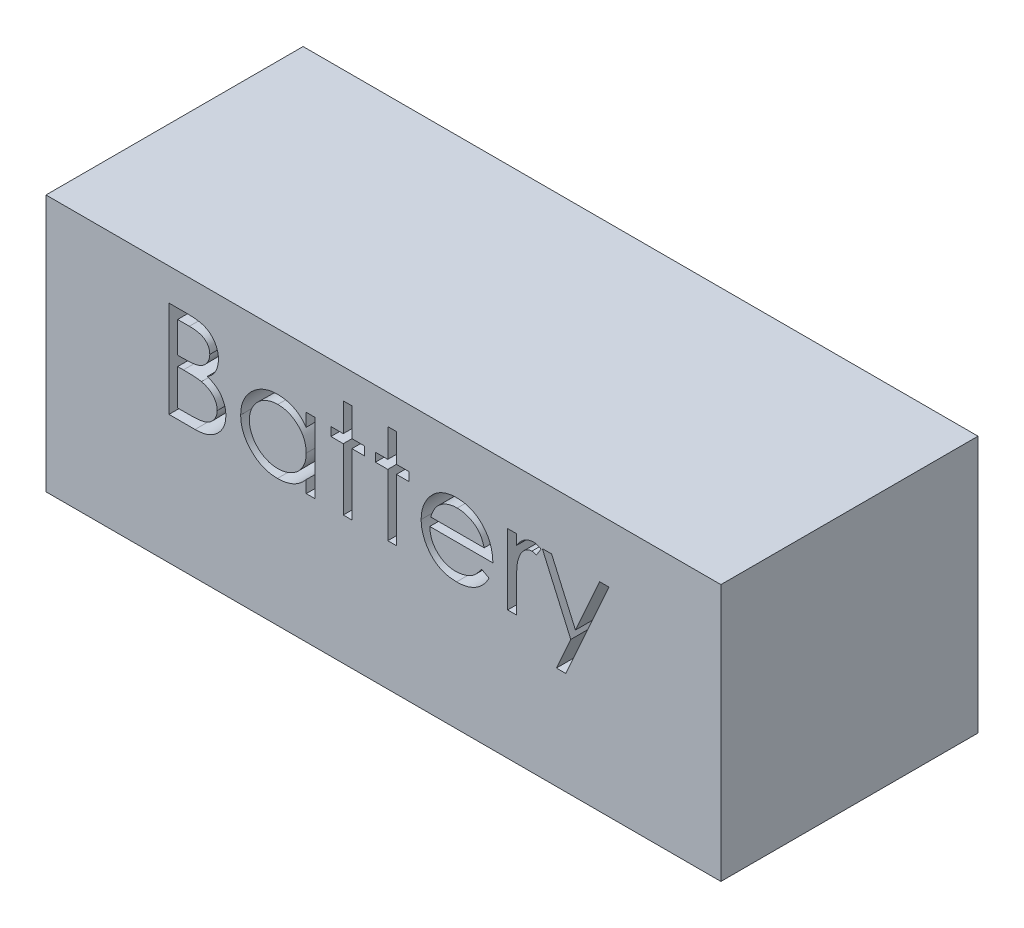
from build123d import *

# Parameters (mm, degrees)
SKETCH1_W           = 133.35
SKETCH1_H           = 50.8
BOSS_EXTRUDE1_DEPTH = 50.8
CUT_EXTRUDE2_DEPTH  = 106.457657268


with BuildPart() as part:
    # Sketch1 → Boss-Extrude1 (new body)
    with BuildSketch(Plane.XY):
        with Locations((-11.928359708, 23.202359192)):
            Rectangle(SKETCH1_W, SKETCH1_H)
    extrude(amount=BOSS_EXTRUDE1_DEPTH)

    # Sketch2 → Cut-Extrude2 (cut, through all)
    # profile 1 of 7: a face of its own
    with BuildSketch(Plane.XY.offset(50.8)):
        with BuildLine():
            Line((-54.302398169, 42.252359192), (-50.58551115, 42.252359192))
            add(Edge.make_bspline(
                [(-50.58551115, 42.252359192), (-50.403564719, 42.251402608), (-50.050907253, 42.249548509), (-49.538084291, 42.220793181), (-49.057758621, 42.181584635), (-48.609790946, 42.119372274), (-48.194388266, 42.044305601), (-47.810298697, 41.953400002), (-47.458743617, 41.844398005), (-47.039030009, 41.671063245), (-46.560490412, 41.413490001), (-46.04233916, 41.03287881), (-45.599267514, 40.567337832), (-45.217253416, 40.042196522), (-44.913535894, 39.464514679), (-44.693811576, 38.848061094), (-44.554703711, 38.200787042), (-44.540397519, 37.756414888), (-44.5331674, 37.531836356)],
                knots=[0, 0, 0, 0, 1.001505555, 1.941167018, 2.826882275, 3.653841531, 4.429895133, 5.150066043, 5.825578002, 6.45369114, 7.647487171, 8.808567382, 9.977351308, 11.170798116, 12.373658725, 13.556498008, 14.765093433, 16, 16, 16, 16], degree=3))
            add(Edge.make_bspline(
                [(-44.5331674, 37.531836356), (-44.539117632, 37.321456017), (-44.550810399, 36.908038811), (-44.662621703, 36.303369445), (-44.837667627, 35.727780668), (-45.080991912, 35.183373113), (-45.397232777, 34.682447305), (-45.772018768, 34.220962328), (-46.224193936, 33.818457289), (-46.562974999, 33.593433777), (-46.735060429, 33.479132029)],
                knots=[0, 0, 0, 0, 1.044552857, 2.05264487, 3.044412934, 4.028983338, 5.005914585, 5.980388656, 6.974128949, 8, 8, 8, 8], degree=3))
            add(Edge.make_bspline(
                [(-46.735060429, 33.479132029), (-46.518650102, 33.39604682), (-46.104603537, 33.237084234), (-45.534812526, 32.95603978), (-45.04389487, 32.650357437), (-44.628076118, 32.316536938), (-44.272452596, 31.956716125), (-43.961921586, 31.565619003), (-43.696955821, 31.138143764), (-43.469918337, 30.678747379), (-43.292760107, 30.192120744), (-43.160085542, 29.682828377), (-43.084062712, 29.152696512), (-43.073244264, 28.791914661), (-43.067782785, 28.609781067)],
                knots=[0, 0, 0, 0, 1.27268992, 2.434971085, 3.483601985, 4.442670788, 5.356604649, 6.2567628, 7.179492994, 8.113709626, 9.066344395, 10.018646069, 10.999752585, 12, 12, 12, 12], degree=3))
            add(Edge.make_bspline(
                [(-43.067782785, 28.609781067), (-43.073099618, 28.423815663), (-43.083560637, 28.057923521), (-43.160740197, 27.520413431), (-43.291418337, 27.006744079), (-43.471419862, 26.513593013), (-43.706346174, 26.041914281), (-43.99224838, 25.591173516), (-44.333143034, 25.165899516), (-44.71448522, 24.761366653), (-45.145897755, 24.397632554), (-45.611347793, 24.073697065), (-46.116697048, 23.807290641), (-46.653645758, 23.583502009), (-47.22821725, 23.412557115), (-47.837831442, 23.292963534), (-48.48196257, 23.212381833), (-48.923975644, 23.20575676), (-49.150655381, 23.202359192)],
                knots=[0, 0, 0, 0, 0.978564426, 1.925352924, 2.850884081, 3.763762016, 4.682927383, 5.618979971, 6.567305752, 7.547517671, 8.540179244, 9.531824382, 10.526200242, 11.540722885, 12.589160233, 13.674978461, 14.80764778, 16, 16, 16, 16], degree=3))
            Line((-49.150655381, 23.202359192), (-54.302398169, 23.202359192))
            Line((-54.302398169, 23.202359192), (-54.302398169, 42.252359192))
        make_face()
        with BuildLine():
            Line((-52.592782785, 40.298513038), (-52.592782785, 34.192743807))
            Line((-52.592782785, 34.192743807), (-51.444134948, 34.192743807))
            add(Edge.make_bspline(
                [(-51.444134948, 34.192743807), (-51.276229362, 34.194920531), (-50.951801552, 34.199126405), (-50.481974687, 34.211174262), (-50.045865659, 34.244909327), (-49.644227253, 34.278634696), (-49.277691951, 34.333469238), (-48.947071791, 34.39874065), (-48.647177999, 34.46777189), (-48.30134133, 34.585171526), (-47.909058567, 34.758677158), (-47.490866957, 35.027945295), (-47.122197916, 35.348662131), (-46.810881794, 35.718727223), (-46.556093647, 36.126213178), (-46.379126141, 36.564618341), (-46.259125922, 37.023016489), (-46.248286302, 37.337712979), (-46.242782785, 37.497491404)],
                knots=[0, 0, 0, 0, 1.156816544, 2.235205308, 3.236616184, 4.169592532, 5.011045266, 5.787822928, 6.49130361, 7.128639758, 8.301311294, 9.436451833, 10.541879658, 11.654887649, 12.756523258, 13.837046038, 14.901820046, 16, 16, 16, 16], degree=3))
            add(Edge.make_bspline(
                [(-46.242782785, 37.497491404), (-46.245646708, 37.603223103), (-46.251264607, 37.810627377), (-46.297274726, 38.112974576), (-46.375475381, 38.397329857), (-46.475919462, 38.667590086), (-46.616283611, 38.915304585), (-46.781547604, 39.149038265), (-46.981222576, 39.360831367), (-47.208501663, 39.558785351), (-47.469805739, 39.734287709), (-47.764978913, 39.887998149), (-48.098014698, 40.011772947), (-48.46330038, 40.12017372), (-48.866458728, 40.196310005), (-49.302837369, 40.259737729), (-49.776010625, 40.292028797), (-50.103371826, 40.296303414), (-50.272590477, 40.298513038)],
                knots=[0, 0, 0, 0, 0.91205012, 1.789085906, 2.630437955, 3.453916878, 4.269457761, 5.079663411, 5.91843418, 6.774407191, 7.675494373, 8.627863946, 9.638891023, 10.736472738, 11.911756761, 13.175263542, 14.539845004, 16, 16, 16, 16], degree=3))
            Line((-50.272590477, 40.298513038), (-52.592782785, 40.298513038))
        make_face(mode=Mode.SUBTRACT)
        with BuildLine():
            Line((-52.592782785, 32.238897654), (-52.592782785, 25.156205346))
            Line((-52.592782785, 25.156205346), (-50.158107304, 25.156205346))
            add(Edge.make_bspline(
                [(-50.158107304, 25.156205346), (-49.983832864, 25.158294028), (-49.647941857, 25.162319688), (-49.16297659, 25.175461763), (-48.713488554, 25.205355435), (-48.301528844, 25.25241356), (-47.922649094, 25.303459119), (-47.581394453, 25.37210052), (-47.274998643, 25.450744148), (-46.919719911, 25.572305856), (-46.519650816, 25.761153791), (-46.088517441, 26.045892652), (-45.705197596, 26.385109513), (-45.379686114, 26.777707774), (-45.112915419, 27.204598282), (-44.918847871, 27.657146544), (-44.799154779, 28.127874915), (-44.784664972, 28.448822307), (-44.777398169, 28.609781067)],
                knots=[0, 0, 0, 0, 1.160039823, 2.235823828, 3.228722157, 4.157150951, 4.99529583, 5.772374946, 6.472645482, 7.099169577, 8.269452708, 9.405989375, 10.527446681, 11.663510218, 12.788923519, 13.866172445, 14.929861265, 16, 16, 16, 16], degree=3))
            add(Edge.make_bspline(
                [(-44.777398169, 28.609781067), (-44.778900966, 28.710437678), (-44.781882318, 28.910127298), (-44.826843665, 29.2035834), (-44.892233442, 29.487841368), (-44.976768818, 29.763673069), (-45.099883346, 30.026091589), (-45.243610398, 30.280286949), (-45.412128885, 30.526595173), (-45.674714987, 30.837993295), (-46.056651075, 31.19677018), (-46.599340809, 31.548038585), (-47.216410031, 31.831327363), (-47.663962528, 31.951611656), (-47.895156583, 32.013747413)],
                knots=[0, 0, 0, 0, 0.723448775, 1.435228256, 2.130040452, 2.821711965, 3.505591119, 4.210454504, 4.921174351, 5.648778258, 7.137944449, 8.670945889, 10.280296675, 12, 12, 12, 12], degree=3))
            add(Edge.make_bspline(
                [(-47.895156583, 32.013747413), (-47.987843519, 32.032552942), (-48.188807914, 32.073327206), (-48.516509173, 32.116367706), (-48.890628688, 32.154712961), (-49.312030349, 32.183076547), (-49.781247313, 32.212394734), (-50.299281684, 32.223796546), (-50.864017925, 32.237399662), (-51.255862124, 32.23838555), (-51.459399371, 32.238897654)],
                knots=[0, 0, 0, 0, 0.634451884, 1.375622551, 2.216452059, 3.157844607, 4.20941857, 5.370758133, 6.634282058, 8, 8, 8, 8], degree=3))
            Line((-51.459399371, 32.238897654), (-52.592782785, 32.238897654))
        make_face(mode=Mode.SUBTRACT)
    # profile 2 of 7: a face of its own
    with BuildSketch(Plane.XY.offset(50.8)):
        with BuildLine():
            Line((-25.4831674, 37.123513038), (-25.4831674, 23.202359192))
            Line((-25.4831674, 23.202359192), (-27.192782785, 23.202359192))
            Line((-27.192782785, 23.202359192), (-27.192782785, 25.610321932))
            add(Edge.make_bspline(
                [(-27.192782785, 25.610321932), (-27.385562202, 25.392392142), (-27.76177366, 24.967099417), (-28.390103173, 24.411480735), (-29.056135684, 23.952221585), (-29.756638589, 23.58129133), (-30.490979314, 23.30266028), (-31.257530017, 23.104615614), (-32.05660339, 22.977286311), (-32.602262636, 22.964571678), (-32.878780381, 22.958128423)],
                knots=[0, 0, 0, 0, 1.074387032, 2.096679803, 3.090159297, 4.057316773, 5.018401886, 5.985159533, 6.978961417, 8, 8, 8, 8], degree=3))
            add(Edge.make_bspline(
                [(-32.878780381, 22.958128423), (-33.124623101, 22.964803392), (-33.60943583, 22.977966726), (-34.322608379, 23.080087265), (-35.008910479, 23.244083934), (-35.668990654, 23.47214449), (-36.298577617, 23.774662962), (-36.903061857, 24.136837469), (-37.479311795, 24.568133987), (-38.018544028, 25.061191684), (-38.515106773, 25.596741543), (-38.950868843, 26.167945162), (-39.31419632, 26.772332559), (-39.618017045, 27.402251582), (-39.852040006, 28.062551359), (-40.015182215, 28.750948516), (-40.117183789, 29.466629113), (-40.130341683, 29.953979946), (-40.137013554, 30.201097173)],
                knots=[0, 0, 0, 0, 1.033919861, 2.038935746, 3.024066025, 3.998881131, 4.97069526, 5.957263378, 6.95902576, 7.993208707, 9.027059324, 10.027763471, 11.009749337, 11.988697705, 12.965288445, 13.950418724, 14.960734635, 16, 16, 16, 16], degree=3))
            add(Edge.make_bspline(
                [(-40.137013554, 30.201097173), (-40.13019381, 30.443106759), (-40.116711543, 30.921546657), (-40.016273304, 31.625192141), (-39.847375957, 32.302927246), (-39.610351243, 32.952570037), (-39.306411459, 33.574906596), (-38.936688586, 34.170377075), (-38.501155921, 34.740621938), (-37.999039249, 35.272232473), (-37.455108571, 35.763290388), (-36.873219622, 36.190059621), (-36.26784719, 36.558632755), (-35.629601376, 36.850660962), (-34.967928991, 37.086930516), (-34.276939522, 37.250395671), (-33.55950793, 37.346719663), (-33.072423966, 37.360668422), (-32.8253549, 37.367743807)],
                knots=[0, 0, 0, 0, 1.020392517, 2.01726096, 2.990465484, 3.961182959, 4.928053699, 5.906110375, 6.912531644, 7.948652711, 8.985773172, 9.998621852, 10.987621588, 11.969261332, 12.953316658, 13.946091881, 14.958173133, 16, 16, 16, 16], degree=3))
            add(Edge.make_bspline(
                [(-32.8253549, 37.367743807), (-32.541238524, 37.359918331), (-31.984099721, 37.344572942), (-31.169151556, 37.216868669), (-30.398200898, 37.001122155), (-29.665296496, 36.707656915), (-28.97307019, 36.317683118), (-28.328075376, 35.825757902), (-27.723561816, 35.234983727), (-27.373149086, 34.781210308), (-27.192782785, 34.547641644)],
                knots=[0, 0, 0, 0, 1.038897134, 2.037228247, 3.008116434, 3.962042015, 4.918381754, 5.904844433, 6.921570401, 8, 8, 8, 8], degree=3))
            Line((-27.192782785, 34.547641644), (-27.192782785, 37.123513038))
            Line((-27.192782785, 37.123513038), (-25.4831674, 37.123513038))
        make_face()
        with BuildLine():
            add(Edge.make_bspline(
                [(-32.802458265, 35.658128423), (-33.052363447, 35.649236766), (-33.545636527, 35.63168605), (-34.269776024, 35.494670312), (-34.962724749, 35.266698448), (-35.621016954, 34.954921243), (-36.234253961, 34.56287912), (-36.782315227, 34.088689876), (-37.269683358, 33.545291271), (-37.679575482, 32.935135498), (-38.013715187, 32.281023317), (-38.248667175, 31.597267447), (-38.403621222, 30.896200355), (-38.419451884, 30.420697736), (-38.427398169, 30.182016644)],
                knots=[0, 0, 0, 0, 1.031046209, 2.035121221, 3.029706178, 4.034933723, 5.034054252, 6.02443088, 7.017295772, 8.038157696, 9.050218397, 10.03989886, 11.016116709, 12, 12, 12, 12], degree=3))
            add(Edge.make_bspline(
                [(-38.427398169, 30.182016644), (-38.417247821, 29.944761918), (-38.396986912, 29.471182424), (-38.251386704, 28.76915957), (-38.007111964, 28.08524257), (-37.673780165, 27.425236305), (-37.256385822, 26.81245713), (-36.772577585, 26.258700177), (-36.217676768, 25.782506847), (-35.603028479, 25.383885196), (-34.946576526, 25.061872047), (-34.256237556, 24.837813352), (-33.544988726, 24.693154289), (-33.061378166, 24.676257065), (-32.817722689, 24.667743807)],
                knots=[0, 0, 0, 0, 0.979072187, 1.954306742, 2.945804271, 3.96968567, 4.997920485, 5.998718438, 6.996577872, 8.005894225, 9.015743152, 10.005417472, 10.995077863, 12, 12, 12, 12], degree=3))
            add(Edge.make_bspline(
                [(-32.817722689, 24.667743807), (-32.570363866, 24.676778754), (-32.078391703, 24.694748366), (-31.352103878, 24.832350682), (-30.647281295, 25.059692284), (-29.973525095, 25.37482896), (-29.345875867, 25.765393997), (-28.782551704, 26.222632592), (-28.306214791, 26.754417066), (-27.902395016, 27.33885176), (-27.585754533, 27.979541341), (-27.355107697, 28.661717436), (-27.218742867, 29.385403794), (-27.201555796, 29.879963168), (-27.192782785, 30.132407269)],
                knots=[0, 0, 0, 0, 1.01762866, 2.023962475, 3.030623092, 4.058876274, 5.077231937, 6.066672613, 7.034107872, 8.005628644, 8.981990164, 9.965428785, 10.961468474, 12, 12, 12, 12], degree=3))
            add(Edge.make_bspline(
                [(-27.192782785, 30.132407269), (-27.198006057, 30.324746032), (-27.208287111, 30.703329585), (-27.286830639, 31.259195074), (-27.411771024, 31.791145782), (-27.587826607, 32.29974099), (-27.819100598, 32.782168717), (-28.098034866, 33.241892897), (-28.429534528, 33.676522519), (-28.808263203, 34.080072663), (-29.222819519, 34.448153836), (-29.661484091, 34.776707775), (-30.129454128, 35.04661238), (-30.618859714, 35.269994158), (-31.130549978, 35.447753246), (-31.668688637, 35.56634055), (-32.227555694, 35.64776744), (-32.608806367, 35.654638399), (-32.802458265, 35.658128423)],
                knots=[0, 0, 0, 0, 1.050140795, 2.067009409, 3.05949893, 4.030605086, 5.00011959, 5.97591094, 6.962425594, 7.979863591, 8.993523472, 9.986985069, 10.967611495, 11.937549037, 12.921786183, 13.919465291, 14.943216303, 16, 16, 16, 16], degree=3))
        make_face(mode=Mode.SUBTRACT)
    # profile 3 of 7: a face of its own
    with BuildSketch(Plane.XY.offset(50.8)):
        Polygon((-19.865859708, 42.740820731), (-18.156244323, 42.740820731), (-18.156244323, 37.123513038), (-15.713936631, 37.123513038), (-15.713936631, 35.413897654), (-18.156244323, 35.413897654), (-18.156244323, 23.202359192), (-19.865859708, 23.202359192), (-19.865859708, 35.413897654), (-22.3081674, 35.413897654), (-22.3081674, 37.123513038), (-19.865859708, 37.123513038), align=None)
    # profile 4 of 7: a face of its own
    with BuildSketch(Plane.XY.offset(50.8)):
        Polygon((-11.073552015, 42.740820731), (-9.363936631, 42.740820731), (-9.363936631, 37.123513038), (-6.921628939, 37.123513038), (-6.921628939, 35.413897654), (-9.363936631, 35.413897654), (-9.363936631, 23.202359192), (-11.073552015, 23.202359192), (-11.073552015, 35.413897654), (-13.515859708, 35.413897654), (-13.515859708, 37.123513038), (-11.073552015, 37.123513038), align=None)
    # profile 5 of 7: a face of its own
    with BuildSketch(Plane.XY.offset(50.8)):
        with BuildLine():
            Line((7.434560965, 27.598513038), (8.953371061, 26.800946932))
            add(Edge.make_bspline(
                [(8.953371061, 26.800946932), (8.83234045, 26.586262515), (8.59686281, 26.168571655), (8.191910168, 25.594721101), (7.767410458, 25.078478533), (7.304201718, 24.6336357), (6.816142466, 24.245824591), (6.300526159, 23.906528716), (5.754668451, 23.617412198), (5.17854352, 23.373830582), (4.567313106, 23.186544621), (3.919495996, 23.054260219), (3.233851142, 22.972490714), (2.76388122, 22.962992162), (2.52323284, 22.958128423)],
                knots=[0, 0, 0, 0, 1.120438281, 2.179929193, 3.190490725, 4.156257408, 5.095198341, 6.022838206, 6.959905092, 7.901321166, 8.864066838, 9.862729781, 10.905609505, 12, 12, 12, 12], degree=3))
            add(Edge.make_bspline(
                [(2.52323284, 22.958128423), (2.255760077, 22.964372334), (1.733998203, 22.976552397), (0.974503293, 23.081558524), (0.259423888, 23.252858077), (-0.411199812, 23.492156238), (-1.035725501, 23.804724959), (-1.615394439, 24.185504425), (-2.153255002, 24.632538554), (-2.632358197, 25.149699482), (-3.06367133, 25.703139849), (-3.444267579, 26.279842592), (-3.762443025, 26.878356714), (-4.021265089, 27.494871995), (-4.230297283, 28.125502615), (-4.375984628, 28.77598646), (-4.459966542, 29.444562997), (-4.472835881, 29.896849925), (-4.479321246, 30.124775057)],
                knots=[0, 0, 0, 0, 1.145258523, 2.234067595, 3.276747158, 4.290159414, 5.277019952, 6.260822364, 7.254936242, 8.264827045, 9.274100331, 10.257902744, 11.220704747, 12.172965371, 13.118907548, 14.062713208, 15.023725156, 16, 16, 16, 16], degree=3))
            add(Edge.make_bspline(
                [(-4.479321246, 30.124775057), (-4.473556491, 30.338651206), (-4.462131508, 30.762525488), (-4.390118223, 31.38989938), (-4.262492513, 31.999654243), (-4.087361378, 32.592296739), (-3.861203881, 33.166834582), (-3.584531374, 33.723617443), (-3.256912861, 34.262052847), (-3.003968736, 34.601704189), (-2.876556823, 34.772791884)],
                knots=[0, 0, 0, 0, 1.024358464, 2.0301432, 3.019427413, 4.004406732, 4.986367066, 5.972626655, 6.978780325, 8, 8, 8, 8], degree=3))
            add(Edge.make_bspline(
                [(-2.876556823, 34.772791884), (-2.703976435, 34.978906734), (-2.364282569, 35.384607239), (-1.789754406, 35.917671555), (-1.167634766, 36.364224103), (-0.505720058, 36.734377229), (0.20368275, 37.015629508), (0.951037606, 37.225220777), (1.744854297, 37.342666809), (2.28753557, 37.359255732), (2.565210004, 37.367743807)],
                knots=[0, 0, 0, 0, 1.030682036, 2.02871468, 2.997146059, 3.962720338, 4.930598197, 5.918074684, 6.934738563, 8, 8, 8, 8], degree=3))
            add(Edge.make_bspline(
                [(2.565210004, 37.367743807), (2.850674827, 37.360373913), (3.410691737, 37.345915859), (4.227295139, 37.211878245), (4.999967039, 36.999320769), (5.728398241, 36.699126567), (6.412662597, 36.311815292), (7.048312381, 35.83207184), (7.646218471, 35.274624823), (7.994063736, 34.845927926), (8.171069379, 34.627779865)],
                knots=[0, 0, 0, 0, 1.056321875, 2.072262726, 3.055038591, 4.01806755, 4.982017516, 5.957941055, 6.960871419, 8, 8, 8, 8], degree=3))
            add(Edge.make_bspline(
                [(8.171069379, 34.627779865), (8.291503143, 34.463386086), (8.531569028, 34.135692783), (8.832271101, 33.6013612), (9.093296351, 33.042322108), (9.301937182, 32.449538919), (9.470880753, 31.830035204), (9.593110009, 31.179382211), (9.664790362, 30.497773693), (9.678880271, 30.033353441), (9.686063369, 29.796589961)],
                knots=[0, 0, 0, 0, 0.94817472, 1.890038105, 2.849395472, 3.817997239, 4.812318967, 5.836947057, 6.897266129, 8, 8, 8, 8], degree=3))
            Line((9.686063369, 29.796589961), (-2.769705862, 29.796589961))
            add(Edge.make_bspline(
                [(-2.769705862, 29.796589961), (-2.761326004, 29.613163149), (-2.744847351, 29.25246172), (-2.668020643, 28.7246636), (-2.546923746, 28.221888695), (-2.376730705, 27.747908138), (-2.170626876, 27.296531301), (-1.918156046, 26.8711065), (-1.61695076, 26.473571481), (-1.280986596, 26.100370346), (-0.907023691, 25.768025346), (-0.513599024, 25.470563535), (-0.095078335, 25.221250216), (0.345238377, 25.018885388), (0.806639093, 24.860463867), (1.289269184, 24.752326158), (1.792178931, 24.679897476), (2.135001284, 24.67184387), (2.309530917, 24.667743807)],
                knots=[0, 0, 0, 0, 1.094153842, 2.151609401, 3.174256925, 4.172055639, 5.149267565, 6.128595816, 7.11444997, 8.118368179, 9.117203808, 10.09244225, 11.054858984, 12.015122123, 12.976791628, 13.957293641, 14.960065497, 16, 16, 16, 16], degree=3))
            add(Edge.make_bspline(
                [(2.309530917, 24.667743807), (2.480170735, 24.671053373), (2.818752867, 24.677620186), (3.322983819, 24.741475301), (3.819043247, 24.844727801), (4.304878027, 24.985643319), (4.770627917, 25.157511614), (5.201950125, 25.364900025), (5.598626727, 25.594315075), (5.969377646, 25.856713449), (6.328992624, 26.177886581), (6.685731014, 26.578675291), (7.068236799, 27.052680264), (7.307665868, 27.40943596), (7.434560965, 27.598513038)],
                knots=[0, 0, 0, 0, 0.99110716, 1.966546729, 2.947904876, 3.932708344, 4.903319531, 5.828989031, 6.710028674, 7.56322171, 8.463672341, 9.504779593, 10.677557249, 12, 12, 12, 12], degree=3))
        make_face()
        with BuildLine():
            add(Edge.make_bspline(
                [(7.976447985, 31.506205346), (7.913873499, 31.732970416), (7.793437759, 32.169420179), (7.541779832, 32.773799883), (7.258361875, 33.31094403), (6.922963594, 33.776741747), (6.542950245, 34.19041801), (6.104010036, 34.551924881), (5.611780387, 34.875325579), (5.068805636, 35.148298469), (4.493812491, 35.380653271), (3.891798789, 35.536455687), (3.277529973, 35.643187625), (2.862053357, 35.653126872), (2.652980436, 35.658128423)],
                knots=[0, 0, 0, 0, 1.154881502, 2.222775134, 3.210006277, 4.132804581, 5.035138423, 5.962687519, 6.919655026, 7.923214229, 8.944639381, 9.960483929, 10.97369054, 12, 12, 12, 12], degree=3))
            add(Edge.make_bspline(
                [(2.652980436, 35.658128423), (2.482349921, 35.654799182), (2.145049266, 35.648217973), (1.648110594, 35.585787697), (1.170882519, 35.48259197), (0.709843739, 35.341268421), (0.27103587, 35.152898741), (-0.154567083, 34.932010037), (-0.55614324, 34.662362273), (-0.807283719, 34.456846221), (-0.934158987, 34.35302025)],
                knots=[0, 0, 0, 0, 1.04873581, 2.073130211, 3.073294108, 4.04793562, 5.032784715, 6.005352987, 6.992311501, 8, 8, 8, 8], degree=3))
            add(Edge.make_bspline(
                [(-0.934158987, 34.35302025), (-1.025018136, 34.270864046), (-1.208894909, 34.104599913), (-1.454588319, 33.81814666), (-1.689831177, 33.509256015), (-1.90391863, 33.166110408), (-2.100283779, 32.792617311), (-2.284034512, 32.391927039), (-2.449423412, 31.960999001), (-2.542475097, 31.660703297), (-2.59034889, 31.506205346)],
                knots=[0, 0, 0, 0, 0.879870761, 1.780643979, 2.707998968, 3.669668524, 4.684282772, 5.740141944, 6.837334558, 8, 8, 8, 8], degree=3))
            Line((-2.59034889, 31.506205346), (7.976447985, 31.506205346))
        make_face(mode=Mode.SUBTRACT)
    # profile 6 of 7: a face of its own
    with BuildSketch(Plane.XY.offset(50.8)):
        with BuildLine():
            Line((12.6168326, 37.123513038), (14.326447985, 37.123513038))
            Line((14.326447985, 37.123513038), (14.326447985, 35.07426424))
            add(Edge.make_bspline(
                [(14.326447985, 35.07426424), (14.452661086, 35.265068106), (14.694042661, 35.629979016), (15.095251605, 36.112593354), (15.506205451, 36.512180965), (15.928871542, 36.83060726), (16.366358057, 37.069075807), (16.809063466, 37.243753612), (17.263952809, 37.347044428), (17.569634139, 37.360834772), (17.722782119, 37.367743807)],
                knots=[0, 0, 0, 0, 1.2804753, 2.448899062, 3.506932113, 4.484331642, 5.4025378, 6.288909075, 7.142734305, 8, 8, 8, 8], degree=3))
            add(Edge.make_bspline(
                [(17.722782119, 37.367743807), (17.841579696, 37.361263941), (18.086013431, 37.347931195), (18.456032956, 37.254255136), (18.837269458, 37.104696184), (19.082973023, 36.964051544), (19.211063369, 36.890730586)],
                knots=[0, 0, 0, 0, 0.901110191, 1.854092781, 2.881294221, 4, 4, 4, 4], degree=3))
            Line((19.211063369, 36.890730586), (18.27230135, 35.410081548))
            add(Edge.make_bspline(
                [(18.27230135, 35.410081548), (18.190065106, 35.446767853), (18.033964973, 35.516405484), (17.805612262, 35.598821282), (17.595075272, 35.647349339), (17.460943905, 35.654701101), (17.398413129, 35.658128423)],
                knots=[0, 0, 0, 0, 1.180555205, 2.24091978, 3.179933427, 4, 4, 4, 4], degree=3))
            add(Edge.make_bspline(
                [(17.398413129, 35.658128423), (17.261221922, 35.648984219), (16.981391628, 35.630332695), (16.570540281, 35.483708613), (16.171866206, 35.246806949), (15.855246158, 34.984074183), (15.61008761, 34.730721171), (15.435152954, 34.509477723), (15.274682574, 34.261399743), (15.121356089, 33.990728178), (14.981658116, 33.692841444), (14.851276274, 33.370715669), (14.733390177, 33.023977753), (14.666169562, 32.782410036), (14.631736446, 32.658669288)],
                knots=[0, 0, 0, 0, 1.125678352, 2.296057538, 3.5422874, 4.923748041, 5.663163013, 6.437101912, 7.23742474, 8.08941207, 8.991984279, 9.93940061, 10.944477711, 12, 12, 12, 12], degree=3))
            add(Edge.make_bspline(
                [(14.631736446, 32.658669288), (14.605978705, 32.548303529), (14.548927266, 32.303851759), (14.493456181, 31.893740503), (14.438649234, 31.409197446), (14.400023354, 30.848873848), (14.36422001, 30.214168975), (14.344026563, 29.504115899), (14.327136612, 28.717985802), (14.326684491, 28.168396823), (14.326447985, 27.880904865)],
                knots=[0, 0, 0, 0, 0.566838948, 1.255505196, 2.06880316, 3.007127437, 4.065329342, 5.249902469, 6.561414163, 8, 8, 8, 8], degree=3))
            Line((14.326447985, 27.880904865), (14.326447985, 23.202359192))
            Line((14.326447985, 23.202359192), (12.6168326, 23.202359192))
            Line((12.6168326, 23.202359192), (12.6168326, 37.123513038))
        make_face()
    # profile 7 of 7: a face of its own
    with BuildSketch(Plane.XY.offset(50.8)):
        Polygon((19.455294138, 37.123513038), (21.298473225, 37.123513038), (26.01136385, 26.461313519), (30.796760485, 37.123513038), (32.643755677, 37.123513038), (24.095678754, 18.073513038), (22.248683561, 18.073513038), (25.084050148, 24.389168086), align=None)
    extrude(amount=-CUT_EXTRUDE2_DEPTH, mode=Mode.SUBTRACT)


with BuildPart() as cut_extrude2_piece_1:
    # of the separate pieces the step leaves, piece 1, a body of its own (cut_extrude2_pieces)
    add(part.part.solids().sort_by_distance((-78.603359708, 48.602359192, 0))[0])


with BuildPart() as cut_extrude2_piece_2:
    # of the separate pieces the step leaves, piece 2, a body of its own (cut_extrude2_pieces)
    add(part.part.solids().sort_by_distance((-32.817722689, 24.667743807, 0))[0])


with BuildPart() as cut_extrude2_piece_3:
    # of the separate pieces the step leaves, piece 3, a body of its own (cut_extrude2_pieces)
    add(part.part.solids().sort_by_distance((-50.158107304, 25.156205346, 0))[0])


with BuildPart() as cut_extrude2_piece_4:
    # of the separate pieces the step leaves, piece 4, a body of its own (cut_extrude2_pieces)
    add(part.part.solids().sort_by_distance((-51.444134948, 34.192743807, 0))[0])


with BuildPart() as cut_extrude2_piece_5:
    # of the separate pieces the step leaves, piece 5, a body of its own (cut_extrude2_pieces)
    add(part.part.solids().sort_by_distance((-0.934158987, 34.35302025, 0))[0])


solid = Compound([cut_extrude2_piece_1.part, cut_extrude2_piece_2.part, cut_extrude2_piece_3.part, cut_extrude2_piece_4.part, cut_extrude2_piece_5.part])
